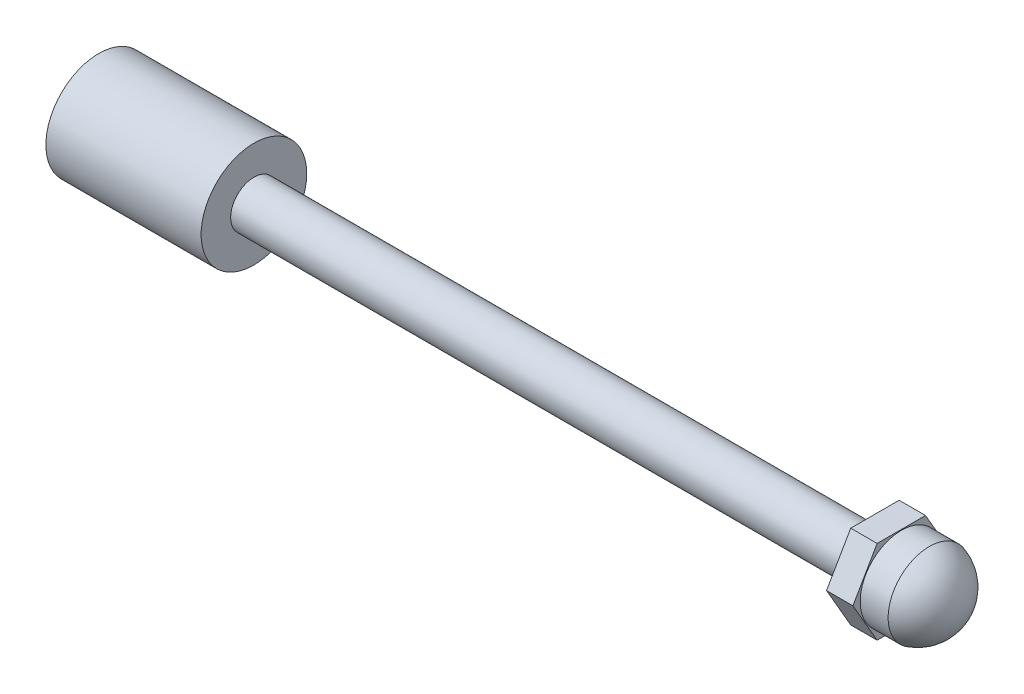
from build123d import *

# Parameters (mm, degrees)
SKETCH8_R           = 3.4
BOSS_EXTRUDE1_DEPTH = 10
SKETCH9_R           = 1.5
BOSS_EXTRUDE2_DEPTH = 40
BOSS_EXTRUDE3_DEPTH = 1.7
SKETCH11_R          = 2.65
BOSS_EXTRUDE4_DEPTH = 1.8
DOME1_FACE_RADIUS   = 2.65
DOME1_HEIGHT        = 2


with BuildPart() as part:
    # Sketch8 → Boss-Extrude1 (new body)
    with BuildSketch(Plane(origin=(0, 0, 0), x_dir=(0, 0, -1), z_dir=(1, 0, 0))):
        Circle(SKETCH8_R)
    extrude(amount=BOSS_EXTRUDE1_DEPTH)

    # Sketch9 → Boss-Extrude2 (add)
    with BuildSketch(Plane(origin=(10, 0, 0), x_dir=(0, 0, -1), z_dir=(1, 0, 0))):
        Circle(SKETCH9_R)
    extrude(amount=BOSS_EXTRUDE2_DEPTH)

    # Sketch10 → Boss-Extrude3 (add)
    with BuildSketch(Plane(origin=(50, 0, 0), x_dir=(0, 0, -1), z_dir=(1, 0, 0))):
        Polygon((-1.558845727, 2.7), (1.558845727, 2.7), (3.117691454, 0), (1.558845727, -2.7), (-1.558845727, -2.7), (-3.117691454, 0), align=None)
    extrude(amount=BOSS_EXTRUDE3_DEPTH)

    # Sketch11 → Boss-Extrude4 (add)
    with BuildSketch(Plane(origin=(51.7, 0, 0), x_dir=(0, 0, -1), z_dir=(1, 0, 0))):
        Circle(SKETCH11_R)
    extrude(amount=BOSS_EXTRUDE4_DEPTH)

    # Dome1: a dome of height H over a round flat face of radius A is a cap of a sphere of radius (A * A + H * H) / (2 * H)
    dome1_r = (DOME1_FACE_RADIUS * DOME1_FACE_RADIUS + DOME1_HEIGHT * DOME1_HEIGHT) / (2 * DOME1_HEIGHT)
    dome1_base = Plane((53.5, 0, 0), z_dir=(1, 0, 0))
    with Locations(dome1_base.offset(DOME1_HEIGHT - dome1_r)):
        dome1_ball = Sphere(dome1_r, mode=Mode.PRIVATE)
    add(split(dome1_ball, bisect_by=dome1_base, keep=Keep.TOP, mode=Mode.PRIVATE))


solid = part.part
